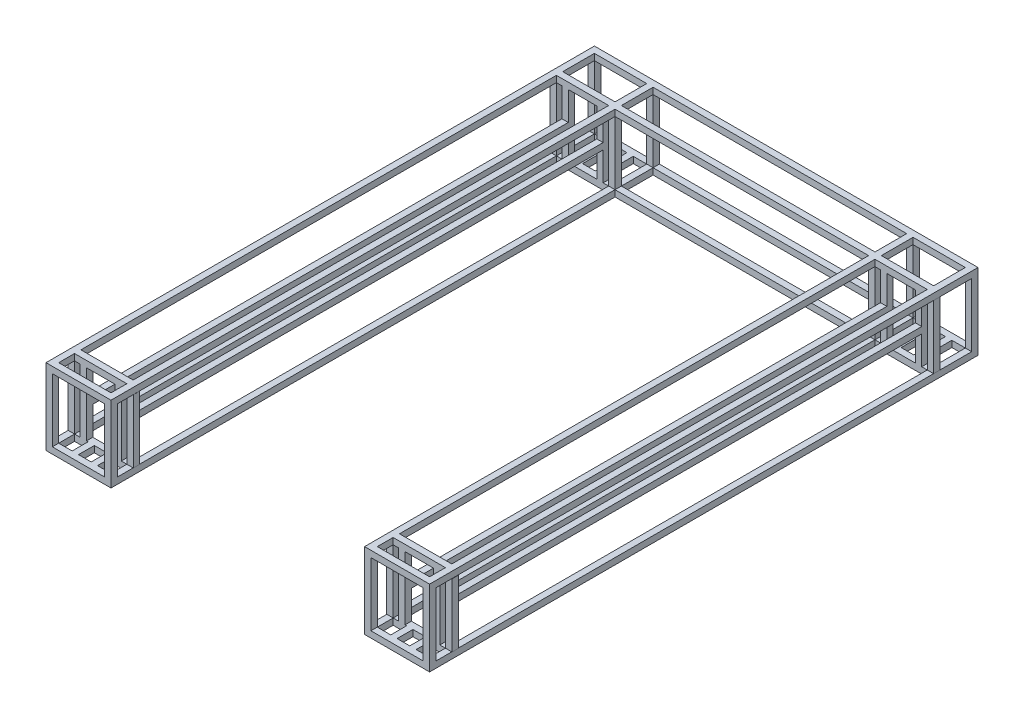
from build123d import *

# Parameters (mm, degrees)
SKETCH1_W           = 20
SKETCH1_H           = 1730
SKETCH1_W_2         = 165
SKETCH1_H_2         = 20
SKETCH1_W_3         = 800
BOSS_EXTRUDE1_DEPTH = 20
LPATTERN1_COUNT     = 2
LPATTERN1_PITCH     = 220
SKETCH2_W           = 20.11323458
SKETCH2_H           = 20
SKETCH2_W_2         = 20
SKETCH2_H_2         = 20.786356151
SKETCH2_W_3         = 20.945730737
SKETCH2_W_4         = 20.439611237
BOSS_EXTRUDE2_DEPTH = 200
SKETCH3_W           = 20
SKETCH3_H           = 100
SKETCH3_H_2         = 50
BOSS_EXTRUDE3_DEPTH = 20
SKETCH4_W           = 20
SKETCH4_H           = 200
BOSS_EXTRUDE4_DEPTH = 20
LPATTERN2_COUNT     = 2
LPATTERN2_PITCH     = 1520
SKETCH5_W           = 20
SKETCH5_H           = 20
BOSS_EXTRUDE5_DEPTH = 1500


with BuildPart() as part:
    # Sketch1 → Boss-Extrude1 (new body)
    with BuildSketch(Plane(origin=(0, 0, 0), x_dir=(1, 0, 0), z_dir=(0, 1, 0))):
        with Locations((-595, 0)):
            Rectangle(SKETCH1_W, SKETCH1_H)
        with Locations((-410, 0)):
            Rectangle(SKETCH1_W, SKETCH1_H)
        with Locations((-502.5, 735)):
            Rectangle(SKETCH1_W_2, SKETCH1_H_2)
        with Locations((-502.5, 855)):
            Rectangle(SKETCH1_W_2, SKETCH1_H_2)
        with Locations((0, 735)):
            Rectangle(SKETCH1_W_3, SKETCH1_H_2)
        with Locations((0, 855)):
            Rectangle(SKETCH1_W_3, SKETCH1_H_2)
        with Locations((502.5, 855)):
            Rectangle(SKETCH1_W_2, SKETCH1_H_2)
        with Locations((410, 0)):
            Rectangle(SKETCH1_W, SKETCH1_H)
        with Locations((502.5, 735)):
            Rectangle(SKETCH1_W_2, SKETCH1_H_2)
        with Locations((595, 0)):
            Rectangle(SKETCH1_W, SKETCH1_H)
        with Locations((502.5, -785)):
            Rectangle(SKETCH1_W_2, SKETCH1_H_2)
        with Locations((502.5, -855)):
            Rectangle(SKETCH1_W_2, SKETCH1_H_2)
        with Locations((-502.5, -785)):
            Rectangle(SKETCH1_W_2, SKETCH1_H_2)
        with Locations((-502.5, -855)):
            Rectangle(SKETCH1_W_2, SKETCH1_H_2)
    extrude(amount=BOSS_EXTRUDE1_DEPTH)


with BuildPart() as lpattern1_1:
    # LPattern1: pattern copy
    add(part.part.moved(Location(Vector(0, -1, 0) * (1 * LPATTERN1_PITCH))))


with BuildPart() as part_1:
    add(part.part)

    add(lpattern1_1.part)  # Boss-Extrude2 merges LPattern1_1
    # Sketch2 → Boss-Extrude2 (add)
    with BuildSketch(Plane(origin=(0, 0, 0), x_dir=(1, 0, 0), z_dir=(0, 1, 0))):
        with Locations((-595.05661729, 735)):
            Rectangle(SKETCH2_W, SKETCH2_H)
        with Locations((-595, 855)):
            Rectangle(SKETCH2_W_2, SKETCH2_H)
        with Locations((-410, 855.393178076)):
            Rectangle(SKETCH2_W_2, SKETCH2_H_2)
        with Locations((-595.472865369, -785)):
            Rectangle(SKETCH2_W_3, SKETCH2_H)
        with Locations((-410, 735)):
            Rectangle(SKETCH2_W_2, SKETCH2_H)
        with Locations((-595, -855)):
            Rectangle(SKETCH2_W_2, SKETCH2_H)
        with Locations((-410, -855)):
            Rectangle(SKETCH2_W_2, SKETCH2_H)
        with Locations((-409.780194381, -785)):
            Rectangle(SKETCH2_W_4, SKETCH2_H)
        with Locations((595.472865369, -785)):
            Rectangle(SKETCH2_W_3, SKETCH2_H)
        with Locations((410, -855)):
            Rectangle(SKETCH2_W_2, SKETCH2_H)
        with Locations((595, -855)):
            Rectangle(SKETCH2_W_2, SKETCH2_H)
        with Locations((410, 735)):
            Rectangle(SKETCH2_W_2, SKETCH2_H)
        with Locations((410, 855.393178076)):
            Rectangle(SKETCH2_W_2, SKETCH2_H_2)
        with Locations((595.05661729, 735)):
            Rectangle(SKETCH2_W, SKETCH2_H)
        with Locations((595, 855)):
            Rectangle(SKETCH2_W_2, SKETCH2_H)
        with Locations((409.780194381, -785)):
            Rectangle(SKETCH2_W_4, SKETCH2_H)
    extrude(amount=-BOSS_EXTRUDE2_DEPTH)

    # Sketch3 → Boss-Extrude3 (add)
    with BuildSketch(Plane.XZ.offset(220)):
        with Locations((-472.5, -795)):
            Rectangle(SKETCH3_W, SKETCH3_H)
        with Locations((-532.5, -795)):
            Rectangle(SKETCH3_W, SKETCH3_H)
        with Locations((-472.5, 820)):
            Rectangle(SKETCH3_W, SKETCH3_H_2)
        with Locations((-532.5, 820)):
            Rectangle(SKETCH3_W, SKETCH3_H_2)
        with Locations((532.5, 820)):
            Rectangle(SKETCH3_W, SKETCH3_H_2)
        with Locations((472.5, 820)):
            Rectangle(SKETCH3_W, SKETCH3_H_2)
        with Locations((532.5, -795)):
            Rectangle(SKETCH3_W, SKETCH3_H)
        with Locations((472.5, -795)):
            Rectangle(SKETCH3_W, SKETCH3_H)
    extrude(amount=-BOSS_EXTRUDE3_DEPTH)

    # Sketch4 → Boss-Extrude4 (add)
    with BuildSketch(Plane.XY.offset(-725)):
        with Locations((-447.5, -100)):
            Rectangle(SKETCH4_W, SKETCH4_H)
        with Locations((-557.5, -100)):
            Rectangle(SKETCH4_W, SKETCH4_H)
        with Locations((557.5, -100)):
            Rectangle(SKETCH4_W, SKETCH4_H)
        with Locations((447.5, -100)):
            Rectangle(SKETCH4_W, SKETCH4_H)
    boss_extrude4 = extrude(amount=-BOSS_EXTRUDE4_DEPTH)

    # LPattern2: Boss-Extrude4 ×2
    with Locations(*[(0, 0, i * LPATTERN2_PITCH) for i in range(1, LPATTERN2_COUNT)]):
        add(boss_extrude4)

    # Sketch5 → Boss-Extrude5 (add)
    with BuildSketch(Plane.XY.offset(-725)):
        with Locations((-557.5, -100)):
            Rectangle(SKETCH5_W, SKETCH5_H)
        with Locations((-447.5, -100)):
            Rectangle(SKETCH5_W, SKETCH5_H)
        with Locations((447.5, -100)):
            Rectangle(SKETCH5_W, SKETCH5_H)
        with Locations((557.5, -100)):
            Rectangle(SKETCH5_W, SKETCH5_H)
    extrude(amount=BOSS_EXTRUDE5_DEPTH)


solid = part_1.part
